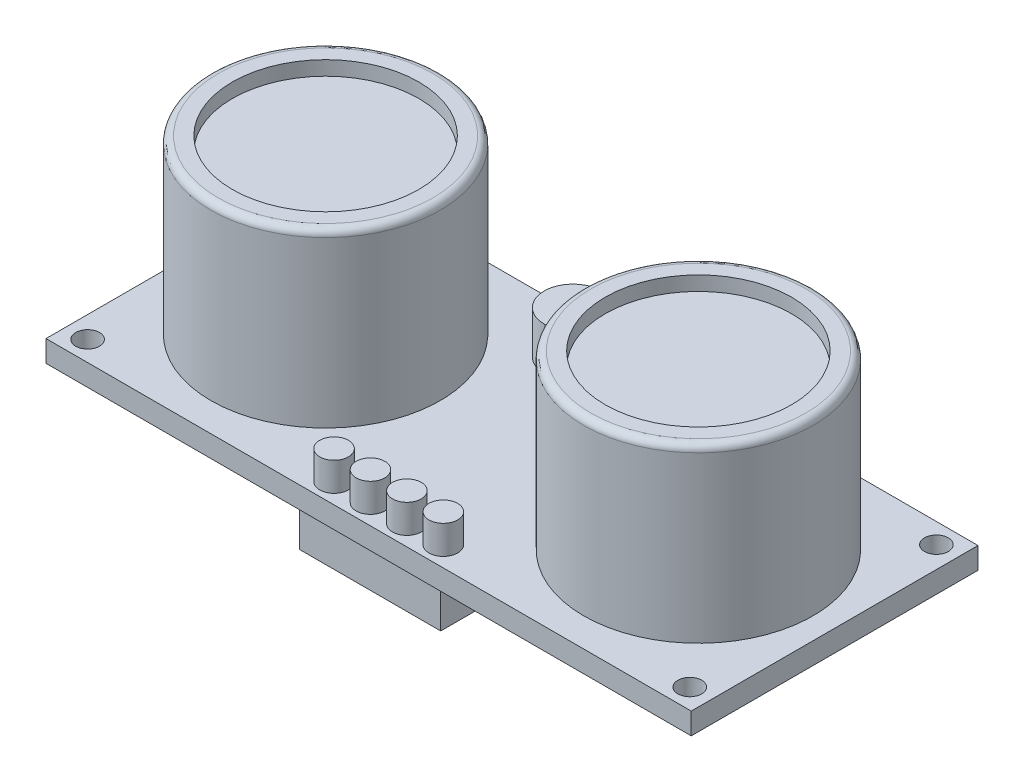
from build123d import *

# Parameters (mm, degrees)
SKETCH1_W           = 45
SKETCH1_H           = 20
BOSS_EXTRUDE1_DEPTH = 1.5
BOSS_EXTRUDE2_DEPTH = 3
SKETCH4_R           = 8
BOSS_EXTRUDE3_DEPTH = 12
SKETCH5_R           = 6.5
CUT_EXTRUDE1_DEPTH  = 1
SKETCH6_R           = 1
BOSS_EXTRUDE4_DEPTH = 2
FILLET1_R           = 0.5
CUT_EXTRUDE2_REACH  = 29.391
SKETCH3_R           = 0.83
SKETCH7_W           = 9.858526848
SKETCH7_H           = 2.639541059
BOSS_EXTRUDE5_DEPTH = 2.5


with BuildPart() as part:
    # Sketch1 → Boss-Extrude1 (new body)
    with BuildSketch(Plane(origin=(0, 0, 0), x_dir=(1, 0, 0), z_dir=(0, 1, 0))):
        Rectangle(SKETCH1_W, SKETCH1_H)
    extrude(amount=BOSS_EXTRUDE1_DEPTH)

    # Sketch2 → Boss-Extrude2 (add)
    with BuildSketch(Plane(origin=(0, 1.5, 0), x_dir=(1, 0, 0), z_dir=(0, 1, 0))):
        with BuildLine():
            Line((-3, 5.25), (3, 5.25))
            ThreePointArc((3, 5.25), (5, 7.25), (3, 9.25))
            Line((3, 9.25), (-3, 9.25))
            ThreePointArc((-3, 9.25), (-5, 7.25), (-3, 5.25))
        make_face()
    extrude(amount=BOSS_EXTRUDE2_DEPTH)

    # Sketch4 → Boss-Extrude3 (add)
    with BuildSketch(Plane(origin=(0, 1.5, 0), x_dir=(1, 0, 0), z_dir=(0, 1, 0))):
        with Locations(Location((-13, 0, 0), (0, 0, 90))):
            Circle(SKETCH4_R)
        with Locations(Location((13, 0, 0), (0, 0, 90))):
            Circle(SKETCH4_R)
    extrude(amount=BOSS_EXTRUDE3_DEPTH)

    # Sketch5 → Cut-Extrude1 (cut)
    with BuildSketch(Plane(origin=(0, 13.5, 0), x_dir=(1, 0, 0), z_dir=(0, 1, 0))):
        with Locations(Location((-13, 0, 0), (0, 0, 270))):
            Circle(SKETCH5_R)
        with Locations(Location((13, 0, 0), (0, 0, 270))):
            Circle(SKETCH5_R)
    extrude(amount=-CUT_EXTRUDE1_DEPTH, mode=Mode.SUBTRACT)

    # Sketch6 → Boss-Extrude4 (add)
    with BuildSketch(Plane(origin=(0, 1.5, 0), x_dir=(1, 0, 0), z_dir=(0, 1, 0))):
        with Locations(Location((-3.81, -8.6, 0), (0, 0, 90))):
            Circle(SKETCH6_R)
        with Locations(Location((-1.27, -8.6, 0), (0, 0, 90))):
            Circle(SKETCH6_R)
        with Locations(Location((1.27, -8.6, 0), (0, 0, 90))):
            Circle(SKETCH6_R)
        with Locations(Location((3.81, -8.6, 0), (0, 0, 90))):
            Circle(SKETCH6_R)
    extrude(amount=BOSS_EXTRUDE4_DEPTH)

    # Fillet1
    fillet1_edges = [part.edges().sort_by_distance(p)[0] for p in [
        (-13, 13.5, 8),
        (13, 13.5, 8),
    ]]
    fillet(fillet1_edges, radius=FILLET1_R)

    # Sketch3 → Cut-Extrude2 (cut, up to next)
    with BuildSketch(Plane(origin=(0, 1.5, 0), x_dir=(1, 0, 0), z_dir=(0, 1, 0)), mode=Mode.PRIVATE) as cut_extrude2_sk1:
        with Locations(Location((-21, 8.6, 0), (0, 0, 270))):
            Circle(SKETCH3_R)
    cut_extrude2_tool1 = extrude(cut_extrude2_sk1.sketch, amount=-CUT_EXTRUDE2_REACH, mode=Mode.PRIVATE) & part.part
    # Sketch3 → Cut-Extrude2 (cut, up to next)
    with BuildSketch(Plane(origin=(0, 1.5, 0), x_dir=(1, 0, 0), z_dir=(0, 1, 0)), mode=Mode.PRIVATE) as cut_extrude2_sk2:
        with Locations(Location((-21, -8.6, 0), (0, 0, 270))):
            Circle(SKETCH3_R)
    cut_extrude2_tool2 = extrude(cut_extrude2_sk2.sketch, amount=-CUT_EXTRUDE2_REACH, mode=Mode.PRIVATE) & part.part
    # Sketch3 → Cut-Extrude2 (cut, up to next)
    with BuildSketch(Plane(origin=(0, 1.5, 0), x_dir=(1, 0, 0), z_dir=(0, 1, 0)), mode=Mode.PRIVATE) as cut_extrude2_sk3:
        with Locations(Location((21, -8.6, 0), (0, 0, 270))):
            Circle(SKETCH3_R)
    cut_extrude2_tool3 = extrude(cut_extrude2_sk3.sketch, amount=-CUT_EXTRUDE2_REACH, mode=Mode.PRIVATE) & part.part
    # Sketch3 → Cut-Extrude2 (cut, up to next)
    with BuildSketch(Plane(origin=(0, 1.5, 0), x_dir=(1, 0, 0), z_dir=(0, 1, 0)), mode=Mode.PRIVATE) as cut_extrude2_sk4:
        with Locations(Location((21, 8.6, 0), (0, 0, 270))):
            Circle(SKETCH3_R)
    cut_extrude2_tool4 = extrude(cut_extrude2_sk4.sketch, amount=-CUT_EXTRUDE2_REACH, mode=Mode.PRIVATE) & part.part
    add(cut_extrude2_tool1.solids().sort_by_distance((-21, 1.5, -8.6))[0], mode=Mode.SUBTRACT)
    add(cut_extrude2_tool2.solids().sort_by_distance((-21, 1.5, 8.6))[0], mode=Mode.SUBTRACT)
    add(cut_extrude2_tool3.solids().sort_by_distance((21, 1.5, 8.6))[0], mode=Mode.SUBTRACT)
    add(cut_extrude2_tool4.solids().sort_by_distance((21, 1.5, -8.6))[0], mode=Mode.SUBTRACT)

    # Sketch7 → Boss-Extrude5 (add)
    with BuildSketch(Plane.XZ):
        with Locations((0, 8.580229471)):
            Rectangle(SKETCH7_W, SKETCH7_H)
    extrude(amount=BOSS_EXTRUDE5_DEPTH)


solid = part.part
